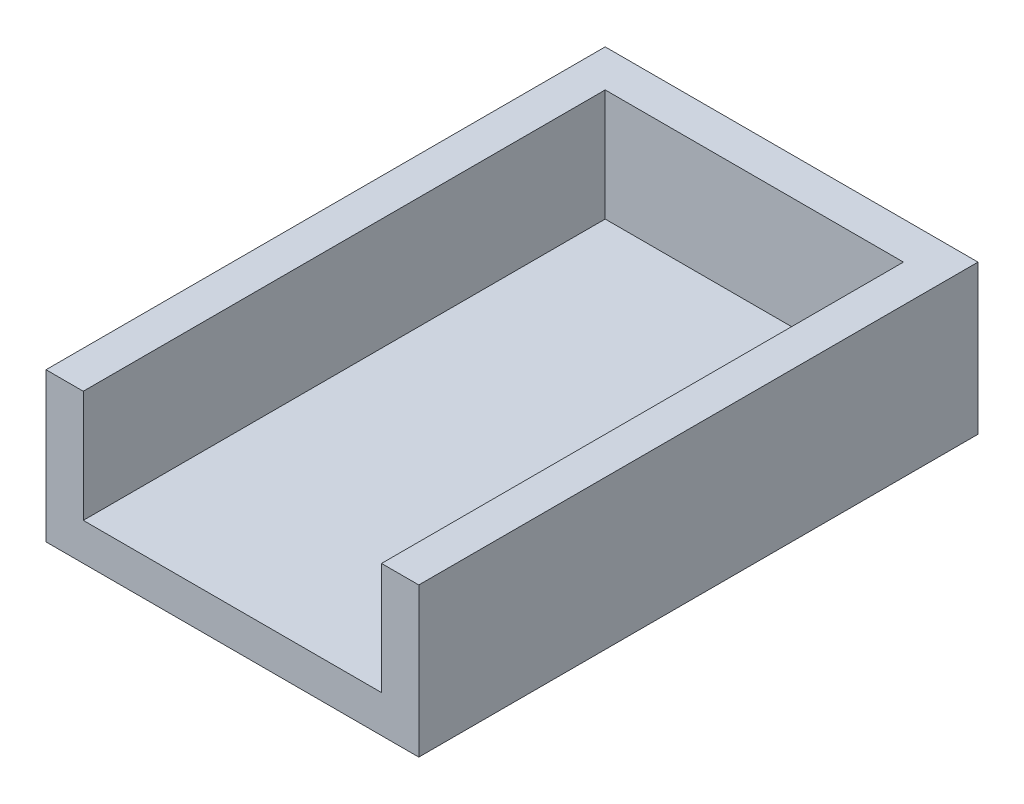
from build123d import *

# Parameters (mm, degrees)
SKETCH1_W           = 100
SKETCH1_H           = 150
BOSS_EXTRUDE1_DEPTH = 40
SKETCH2_W           = 80
SKETCH2_H           = 130
CUT_EXTRUDE1_DEPTH  = 30
SKETCH3_W           = 80
SKETCH3_H           = 30
CUT_EXTRUDE2_DEPTH  = 30


with BuildPart() as part:
    # Sketch1 → Boss-Extrude1 (new body)
    with BuildSketch(Plane(origin=(0, 0, 0), x_dir=(1, 0, 0), z_dir=(0, 1, 0))):
        Rectangle(SKETCH1_W, SKETCH1_H)
    extrude(amount=BOSS_EXTRUDE1_DEPTH)

    # Sketch2 → Cut-Extrude1 (cut)
    with BuildSketch(Plane(origin=(0, 40, 0), x_dir=(1, 0, 0), z_dir=(0, 1, 0))):
        Rectangle(SKETCH2_W, SKETCH2_H)
    extrude(amount=-CUT_EXTRUDE1_DEPTH, mode=Mode.SUBTRACT)

    # Sketch3 → Cut-Extrude2 (cut)
    with BuildSketch(Plane.XY.offset(75)):
        with Locations((0, 25)):
            Rectangle(SKETCH3_W, SKETCH3_H)
    extrude(amount=-CUT_EXTRUDE2_DEPTH, mode=Mode.SUBTRACT)


solid = part.part
